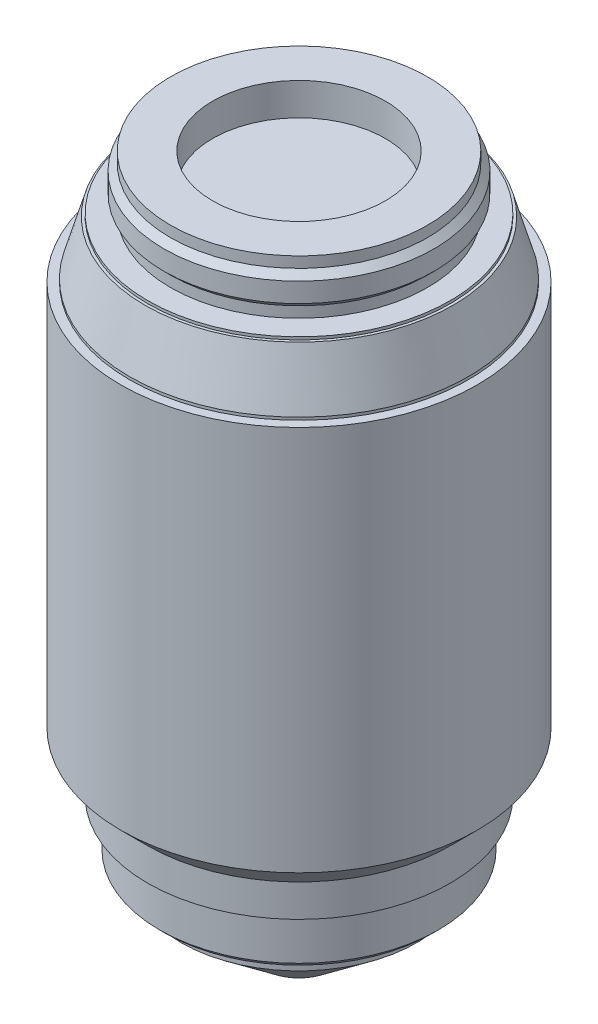
from build123d import *

# Parameters (mm, degrees)
SKETCH2_R          = 8
CUT_EXTRUDE1_DEPTH = 3
SKETCH3_R          = 2.5
CUT_EXTRUDE2_DEPTH = 0.01


with BuildPart() as part:
    # Sketch1 → Revolve1 (revolve)
    with BuildSketch(Plane(origin=(0, 0, 0), x_dir=(0, 0, -1), z_dir=(1, 0, 0))):
        Polygon((0, 32), (0, -32), (-3.25, -32), (-10.9, -26.023164957), (-10.9, -24.5), (-12.4, -24.5), (-12.9, -24), (-12.9, -19.7), (-14, -19.7), (-14, -16.7), (-16.5, -14.2), (-16.5, 21.5), (-15.683726929, 21.5), (-15.683726929, 21.75), (-14.25, 26.75), (-14, 26.75), (-14, 27), (-11.9, 27), (-11.9, 28), (-12.5, 28.6), (-12.5, 30.4), (-11.9, 31), (-11.9, 32), align=None)
    revolve(axis=Axis((0, 40, 0), (0, -1, 0)))

    # Sketch2 → Cut-Extrude1 (cut)
    with BuildSketch(Plane(origin=(0, 32, 0), x_dir=(1, 0, 0), z_dir=(0, 1, 0))):
        Circle(SKETCH2_R)
    extrude(amount=-CUT_EXTRUDE1_DEPTH, mode=Mode.SUBTRACT)

    # Sketch3 → Cut-Extrude2 (cut)
    with BuildSketch(Plane(origin=(0, -32, 0), x_dir=(-1, 0, 0), z_dir=(0, -1, 0))):
        Circle(SKETCH3_R)
    extrude(amount=-CUT_EXTRUDE2_DEPTH, mode=Mode.SUBTRACT)


solid = part.part
